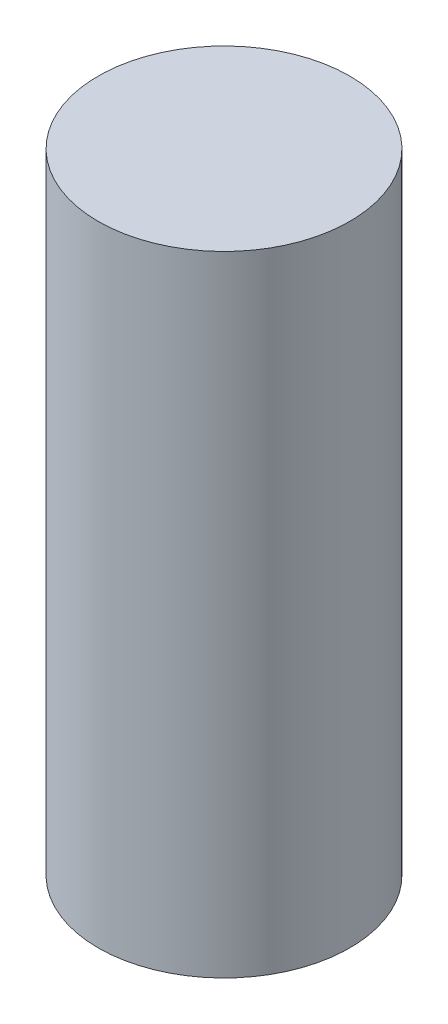
from build123d import *

# Parameters (mm, degrees)
SKETCH1_R           = 3
BOSS_EXTRUDE1_DEPTH = 15


with BuildPart() as part:
    # Sketch1 → Boss-Extrude1 (new body)
    with BuildSketch(Plane(origin=(0, 0, 0), x_dir=(1, 0, 0), z_dir=(0, 1, 0))):
        with Locations(Location((0, 0, 0), (0, 0, 270))):
            Circle(SKETCH1_R)
    extrude(amount=BOSS_EXTRUDE1_DEPTH)


solid = part.part
